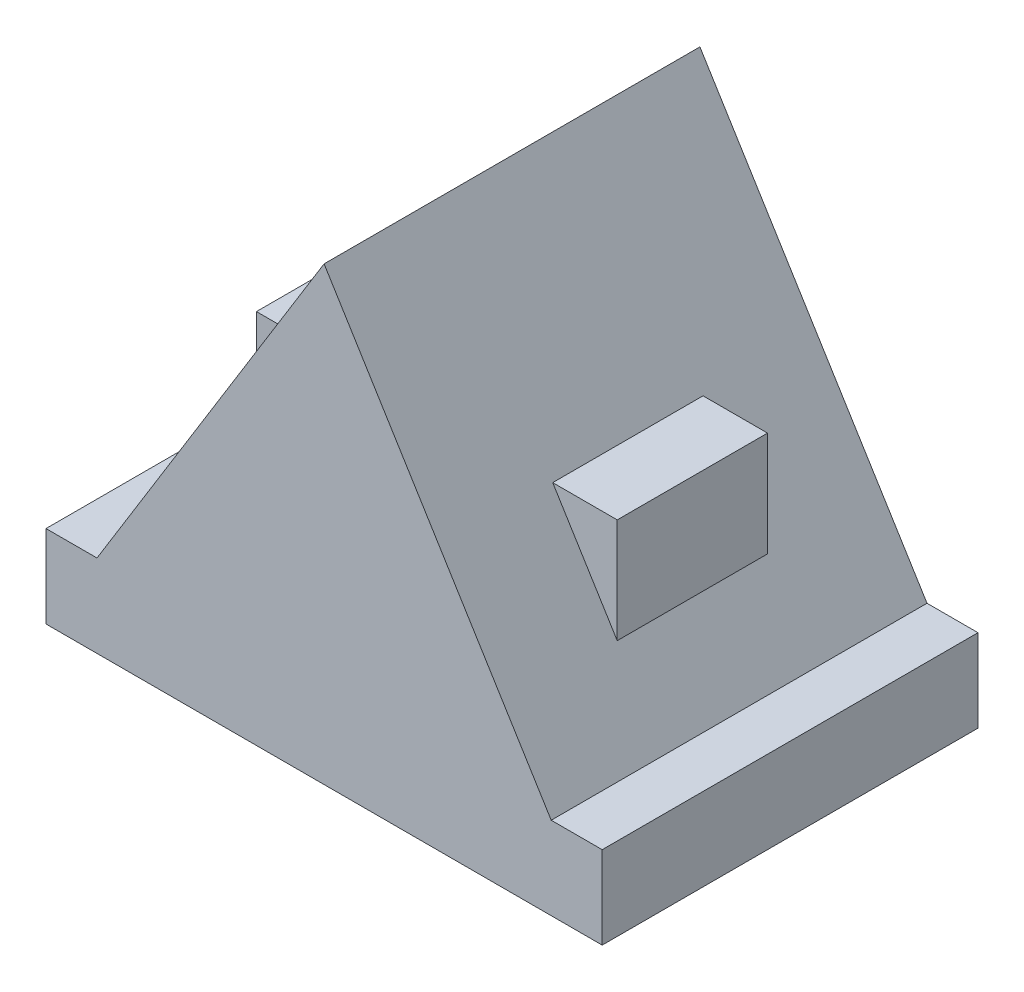
from build123d import *

# Parameters (mm, degrees)
EXTRUDE_1_DEPTH = 25
EXTRUDE_2_DEPTH = 10


with BuildPart() as part:
    # Эскиз1 → Бобышка-Вытянуть1 (new, symmetric)
    with BuildSketch(Plane.XY):
        Polygon((-11.716666667, -19), (-18.5, -19), (-18.5, -30), (18.5, -30), (18.5, 30), align=None)
    extrude_1 = extrude(amount=EXTRUDE_1_DEPTH, both=True)

    # Эскиз1<3> → Бобышка-Вытянуть2 (add, symmetric)
    with BuildSketch(Plane.XY):
        Polygon((-5.5, 5), (-5.5, -8.918918919), (3.083333333, 5), align=None)
    extrude_2 = extrude(amount=EXTRUDE_2_DEPTH, both=True)

    # Зеркальное отражение1: Бобышка-Вытянуть1, Бобышка-Вытянуть2 across plane
    add(extrude_1.mirror(Plane(origin=(18.5, 0, -25), x_dir=(0, 0, 1), z_dir=(1, 0, 0))))
    add(extrude_2.mirror(Plane(origin=(18.5, 0, -25), x_dir=(0, 0, 1), z_dir=(1, 0, 0))))


solid = part.part
